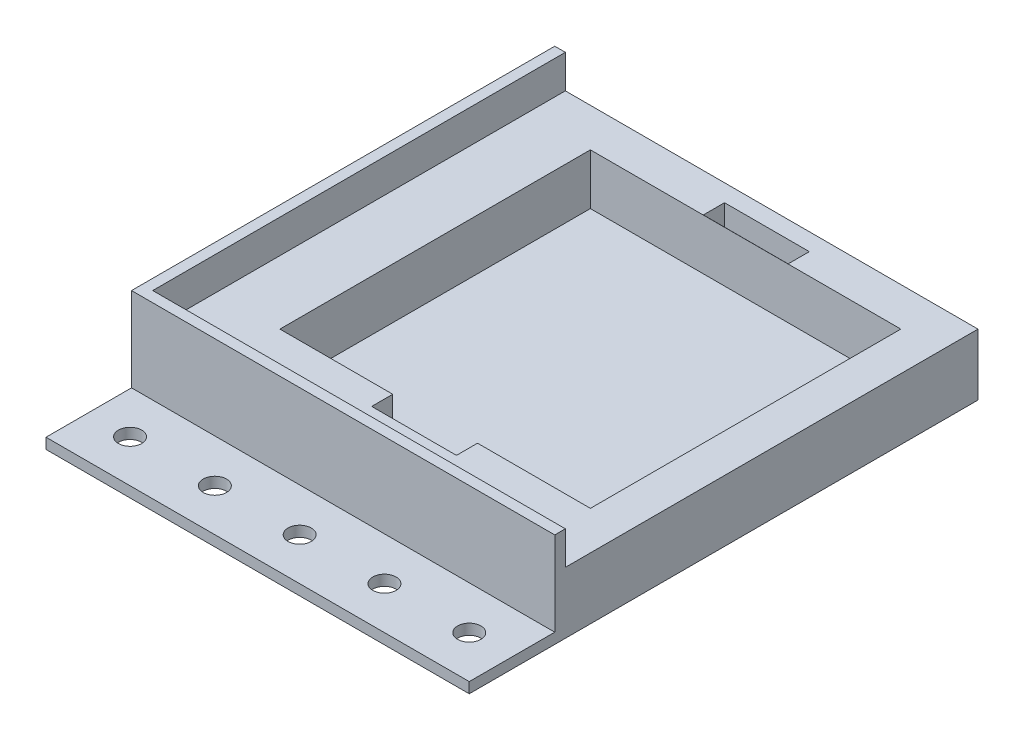
from build123d import *

# Parameters (mm, degrees)
SKETCH1_W               = 304.8
SKETCH1_H               = 304.8
SKETCH1_W_2             = 93
SKETCH1_H_2             = 93
BOSS_EXTRUDE1_DEPTH     = 15.24
SKETCH2_W               = 304.8
SKETCH2_H               = 304.8
BOSS_EXTRUDE2_DEPTH     = 3.175
SKETCH3_W               = 304.8
SKETCH3_H               = 304.8
SKETCH3_W_2             = 247.214
SKETCH3_H_2             = 247.214
BOSS_EXTRUDE3_DEPTH     = 10
SKETCH4_OUTSIDE_W       = 393.198
SKETCH4_OUTSIDE_H       = 393.198
SKETCH4_OUTSIDE_W_2     = 253.564
SKETCH4_OUTSIDE_H_2     = 253.564
CUT_EXTRUDE1_DEPTH      = 25.24
SKETCH5_R               = 3.4925
CUT_EXTRUDE2_DEPTH      = 217.999026726
SKETCH6_W               = 25.4
SKETCH6_H               = 6.35
CUT_EXTRUDE3_DEPTH      = 15.24
LPATTERN1_COUNT         = 2
LPATTERN1_PITCH         = 116.078
LPATTERN1_COUNT_DIR2    = 2
LPATTERN1_PITCH_DIR2    = 116.078
SKETCH7_W               = 388.208697242
SKETCH7_H               = 185.968986832
CUT_EXTRUDE4_DEPTH      = 320.069595424
SKETCH8_W               = 545.051384684
SKETCH8_H               = 463.265958
CUT_EXTRUDE5_DEPTH      = 320.069595424
SKETCH9_W               = 585.539242267
SKETCH9_H               = 383.639310532
CUT_EXTRUDE6_DEPTH      = 297.913320173
CUT_EXTRUDE7_DEPTH      = 200.841169742
CUT_EXTRUDE7_DEPTH_BACK = 200.841169742
SKETCH10_OUTSIDE_W      = 331.206
SKETCH10_OUTSIDE_H      = 356.824
SKETCH10_OUTSIDE_W_2    = 142.114384532
SKETCH10_OUTSIDE_H_2    = 171.89804786


with BuildPart() as part:
    # Sketch1 → Boss-Extrude1 (new body)
    with BuildSketch(Plane(origin=(0, 0, 0), x_dir=(1, 0, 0), z_dir=(0, 1, 0))):
        Rectangle(SKETCH1_W, SKETCH1_H)
        with Locations((58.057, 58.057)):
            Rectangle(SKETCH1_W_2, SKETCH1_H_2, mode=Mode.SUBTRACT)
        with Locations((-58.057, 58.057)):
            Rectangle(SKETCH1_W_2, SKETCH1_H_2, mode=Mode.SUBTRACT)
        with Locations((-58.057, -58.057)):
            Rectangle(SKETCH1_W_2, SKETCH1_H_2, mode=Mode.SUBTRACT)
        with Locations((58.057, -58.057)):
            Rectangle(SKETCH1_W_2, SKETCH1_H_2, mode=Mode.SUBTRACT)
    extrude(amount=BOSS_EXTRUDE1_DEPTH)

    # Sketch2 → Boss-Extrude2 (add)
    with BuildSketch(Plane(origin=(0, 0, 0), x_dir=(-1, 0, 0), z_dir=(0, -1, 0))):
        Rectangle(SKETCH2_W, SKETCH2_H)
    extrude(amount=BOSS_EXTRUDE2_DEPTH)

    # Sketch3 → Boss-Extrude3 (add)
    with BuildSketch(Plane(origin=(0, 15.24, 0), x_dir=(1, 0, 0), z_dir=(0, 1, 0))):
        Rectangle(SKETCH3_W, SKETCH3_H)
        Rectangle(SKETCH3_W_2, SKETCH3_H_2, mode=Mode.SUBTRACT)
    extrude(amount=BOSS_EXTRUDE3_DEPTH)

    # Sketch4 outside → Cut-Extrude1 (cut)
    with BuildSketch(Plane(origin=(0, 25.24, 0), x_dir=(1, 0, 0), z_dir=(0, 1, 0))):
        Rectangle(SKETCH4_OUTSIDE_W, SKETCH4_OUTSIDE_H)
        Rectangle(SKETCH4_OUTSIDE_W_2, SKETCH4_OUTSIDE_H_2, mode=Mode.SUBTRACT)
    extrude(amount=-CUT_EXTRUDE1_DEPTH, mode=Mode.SUBTRACT)

    # Sketch5 → Cut-Extrude2 (cut, through all)
    with BuildSketch(Plane(origin=(0, 0, 0), x_dir=(1, 0, 0), z_dir=(0, 1, 0))):
        with Locations(Location((-139.7, -139.7, 0), (0, 0, 270))):
            Circle(SKETCH5_R)
        with Locations(Location((-114.3, -139.7, 0), (0, 0, 270))):
            Circle(SKETCH5_R)
        with Locations(Location((-88.9, -139.7, 0), (0, 0, 270))):
            Circle(SKETCH5_R)
        with Locations(Location((-63.5, -139.7, 0), (0, 0, 270))):
            Circle(SKETCH5_R)
        with Locations(Location((-38.1, -139.7, 0), (0, 0, 270))):
            Circle(SKETCH5_R)
        with Locations(Location((-12.7, -139.7, 0), (0, 0, 270))):
            Circle(SKETCH5_R)
        with Locations(Location((12.7, -139.7, 0), (0, 0, 270))):
            Circle(SKETCH5_R)
        with Locations(Location((38.1, -139.7, 0), (0, 0, 270))):
            Circle(SKETCH5_R)
        with Locations(Location((63.5, -139.7, 0), (0, 0, 270))):
            Circle(SKETCH5_R)
        with Locations(Location((88.9, -139.7, 0), (0, 0, 270))):
            Circle(SKETCH5_R)
        with Locations(Location((114.3, -139.7, 0), (0, 0, 270))):
            Circle(SKETCH5_R)
        with Locations(Location((139.7, -139.7, 0), (0, 0, 270))):
            Circle(SKETCH5_R)
        with Locations(Location((-139.7, -114.3, 0), (0, 0, 270))):
            Circle(SKETCH5_R)
        with Locations(Location((-139.7, -88.9, 0), (0, 0, 270))):
            Circle(SKETCH5_R)
        with Locations(Location((-139.7, -63.5, 0), (0, 0, 270))):
            Circle(SKETCH5_R)
        with Locations(Location((-139.7, -38.1, 0), (0, 0, 270))):
            Circle(SKETCH5_R)
        with Locations(Location((-139.7, -12.7, 0), (0, 0, 270))):
            Circle(SKETCH5_R)
        with Locations(Location((-139.7, 12.7, 0), (0, 0, 270))):
            Circle(SKETCH5_R)
        with Locations(Location((-139.7, 38.1, 0), (0, 0, 270))):
            Circle(SKETCH5_R)
        with Locations(Location((-139.7, 63.5, 0), (0, 0, 270))):
            Circle(SKETCH5_R)
        with Locations(Location((-139.7, 88.9, 0), (0, 0, 270))):
            Circle(SKETCH5_R)
        with Locations(Location((-139.7, 114.3, 0), (0, 0, 270))):
            Circle(SKETCH5_R)
        with Locations(Location((-139.7, 139.7, 0), (0, 0, 270))):
            Circle(SKETCH5_R)
        with Locations(Location((-114.3, 139.7, 0), (0, 0, 270))):
            Circle(SKETCH5_R)
        with Locations(Location((-88.9, 139.7, 0), (0, 0, 270))):
            Circle(SKETCH5_R)
        with Locations(Location((-63.5, 139.7, 0), (0, 0, 270))):
            Circle(SKETCH5_R)
        with Locations(Location((-38.1, 139.7, 0), (0, 0, 270))):
            Circle(SKETCH5_R)
        with Locations(Location((-12.7, 139.7, 0), (0, 0, 270))):
            Circle(SKETCH5_R)
        with Locations(Location((12.7, 139.7, 0), (0, 0, 270))):
            Circle(SKETCH5_R)
        with Locations(Location((38.1, 139.7, 0), (0, 0, 270))):
            Circle(SKETCH5_R)
        with Locations(Location((63.5, 139.7, 0), (0, 0, 270))):
            Circle(SKETCH5_R)
        with Locations(Location((88.9, 139.7, 0), (0, 0, 270))):
            Circle(SKETCH5_R)
        with Locations(Location((114.3, 139.7, 0), (0, 0, 270))):
            Circle(SKETCH5_R)
        with Locations(Location((139.7, 139.7, 0), (0, 0, 270))):
            Circle(SKETCH5_R)
        with Locations(Location((139.7, 114.3, 0), (0, 0, 270))):
            Circle(SKETCH5_R)
        with Locations(Location((139.7, 88.9, 0), (0, 0, 270))):
            Circle(SKETCH5_R)
        with Locations(Location((139.7, 63.5, 0), (0, 0, 270))):
            Circle(SKETCH5_R)
        with Locations(Location((139.7, 38.1, 0), (0, 0, 270))):
            Circle(SKETCH5_R)
        with Locations(Location((139.7, 12.7, 0), (0, 0, 270))):
            Circle(SKETCH5_R)
        with Locations(Location((139.7, -12.7, 0), (0, 0, 270))):
            Circle(SKETCH5_R)
        with Locations(Location((139.7, -38.1, 0), (0, 0, 270))):
            Circle(SKETCH5_R)
        with Locations(Location((139.7, -63.5, 0), (0, 0, 270))):
            Circle(SKETCH5_R)
        with Locations(Location((139.7, -88.9, 0), (0, 0, 270))):
            Circle(SKETCH5_R)
        with Locations(Location((139.7, -114.3, 0), (0, 0, 270))):
            Circle(SKETCH5_R)
    extrude(amount=-CUT_EXTRUDE2_DEPTH, mode=Mode.SUBTRACT)

    # Sketch6 → Cut-Extrude3 (cut)
    with BuildSketch(Plane(origin=(0, 15.24, 0), x_dir=(1, 0, 0), z_dir=(0, 1, 0))):
        with Locations((-58.057, 107.732)):
            Rectangle(SKETCH6_W, SKETCH6_H)
        with Locations((-58.057, 8.382)):
            Rectangle(SKETCH6_W, SKETCH6_H)
    cut_extrude3 = extrude(amount=-CUT_EXTRUDE3_DEPTH, mode=Mode.SUBTRACT)

    # LPattern1: Cut-Extrude3 2 × 2
    with Locations(*[(i * LPATTERN1_PITCH, 0, j * LPATTERN1_PITCH_DIR2) for i in range(LPATTERN1_COUNT) for j in range(LPATTERN1_COUNT_DIR2) if (i, j) != (0, 0)]):
        add(cut_extrude3, mode=Mode.SUBTRACT)

    # Sketch7 → Cut-Extrude4 (cut, through all)
    with BuildSketch(Plane(origin=(0, 0, -126.782), x_dir=(-1, 0, 0), z_dir=(0, 0, -1))):
        with Locations((-26.237813245, -25.540582214)):
            Rectangle(SKETCH7_W, SKETCH7_H)
    extrude(amount=CUT_EXTRUDE4_DEPTH, mode=Mode.SUBTRACT)

    # Sketch8 → Cut-Extrude5 (cut, through all)
    with BuildSketch(Plane.ZY.offset(126.782)):
        with Locations((35.238029092, 25.908608745)):
            Rectangle(SKETCH8_W, SKETCH8_H)
    extrude(amount=CUT_EXTRUDE5_DEPTH, mode=Mode.SUBTRACT)

    # Sketch9 → Cut-Extrude6 (cut, through all)
    with BuildSketch(Plane(origin=(126.782, 0, 0), x_dir=(0, 0, -1), z_dir=(1, 0, 0))):
        with Locations((26.844145207, 44.758305083)):
            Rectangle(SKETCH9_W, SKETCH9_H)
    extrude(amount=CUT_EXTRUDE6_DEPTH, mode=Mode.SUBTRACT)

    # Sketch10 outside → Cut-Extrude7 (cut, two sides: drawn at the far end of the back side and taken through both)
    with BuildSketch(Plane(origin=(0, 0, 0), x_dir=(1, 0, 0), z_dir=(0, 1, 0)).offset(-CUT_EXTRUDE7_DEPTH_BACK)):
        with Locations((0, -12.809)):
            Rectangle(SKETCH10_OUTSIDE_W, SKETCH10_OUTSIDE_H)
        with Locations((-71.057192266, -85.94902393)):
            Rectangle(SKETCH10_OUTSIDE_W_2, SKETCH10_OUTSIDE_H_2, mode=Mode.SUBTRACT)
    extrude(amount=CUT_EXTRUDE7_DEPTH + CUT_EXTRUDE7_DEPTH_BACK, mode=Mode.SUBTRACT)


solid = part.part
